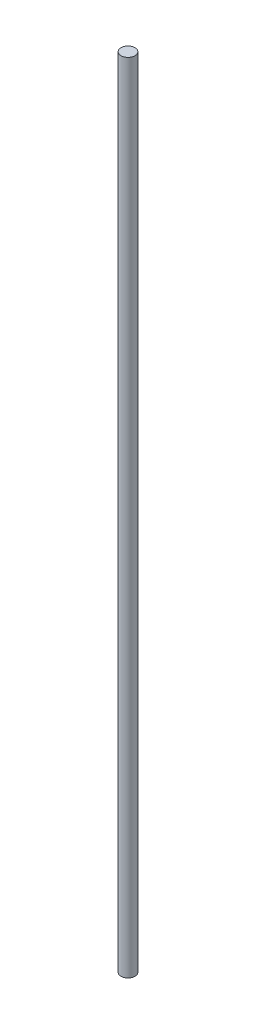
from build123d import *

# Parameters (mm, degrees)
SKETCH1_R           = 1.4
BOSS_EXTRUDE1_DEPTH = 160


with BuildPart() as part:
    # Sketch1 → Boss-Extrude1 (new body)
    with BuildSketch(Plane(origin=(0, 0, 0), x_dir=(1, 0, 0), z_dir=(0, 1, 0))):
        with Locations(Location((0, 0, 0), (0, 0, 270))):
            Circle(SKETCH1_R)
    extrude(amount=BOSS_EXTRUDE1_DEPTH)


solid = part.part
